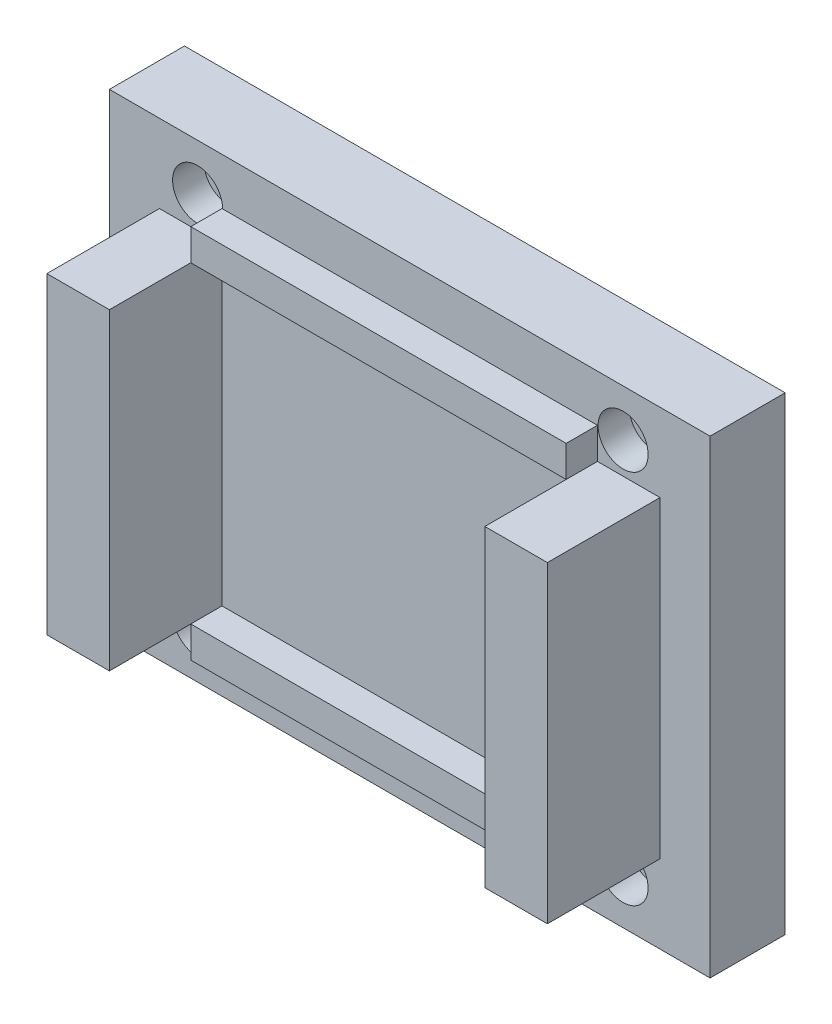
from build123d import *

# Parameters (mm, degrees)
SKETCH_1_W          = 96
SKETCH_1_H          = 75
EXTRUDE_1_DEPTH     = 12
SKETCH_2_R          = 4
CUT_EXTRUDE_1_DEPTH = 5
SKETCH_3_R          = 2.5
CUT_EXTRUDE_2_DEPTH = 123.413234579
SKETCH_4_W          = 10
SKETCH_4_H          = 50
EXTRUDE_2_DEPTH     = 18
SKETCH_5_W          = 60
SKETCH_5_H          = 5
EXTRUDE_7_DEPTH     = 5
SKETCH_6_W          = 60
SKETCH_6_H          = 5
EXTRUDE_8_DEPTH     = 5


with BuildPart() as part:
    # 스케치1 → 보스-돌출1 (new body)
    with BuildSketch(Plane.XY):
        with Locations((48, 37.5)):
            Rectangle(SKETCH_1_W, SKETCH_1_H)
    extrude(amount=EXTRUDE_1_DEPTH)

    # 스케치2 → 컷-돌출1 (cut)
    with BuildSketch(Plane.XY.offset(12)):
        with Locations((14.09562434, 67.5)):
            Circle(SKETCH_2_R)
        with Locations((82.09562434, 67.5)):
            Circle(SKETCH_2_R)
        with Locations((82.09562434, 7.5)):
            Circle(SKETCH_2_R)
        with Locations((14.09562434, 7.5)):
            Circle(SKETCH_2_R)
    extrude(amount=-CUT_EXTRUDE_1_DEPTH, mode=Mode.SUBTRACT)

    # 스케치3 → 컷-돌출2 (cut, through all)
    with BuildSketch(Plane.XY.offset(12)):
        with Locations((14.09562434, 67.5)):
            Circle(SKETCH_3_R)
        with Locations((82.09562434, 67.5)):
            Circle(SKETCH_3_R)
        with Locations((82.09562434, 7.5)):
            Circle(SKETCH_3_R)
        with Locations((14.09562434, 7.5)):
            Circle(SKETCH_3_R)
    extrude(amount=-CUT_EXTRUDE_2_DEPTH, mode=Mode.SUBTRACT)

    # 스케치4 → 보스-돌출2 (add)
    with BuildSketch(Plane.XY.offset(12)):
        with Locations((13, 37.5)):
            Rectangle(SKETCH_4_W, SKETCH_4_H)
        with Locations((83, 37.5)):
            Rectangle(SKETCH_4_W, SKETCH_4_H)
    extrude(amount=EXTRUDE_2_DEPTH)


with BuildPart() as body_2:
    # 스케치5 → 보스-돌출7 (new body)
    with BuildSketch(Plane.XY.offset(12)):
        with Locations((48, 65)):
            Rectangle(SKETCH_5_W, SKETCH_5_H)
    extrude(amount=EXTRUDE_7_DEPTH)


with BuildPart() as body_3:
    # 스케치6 → 보스-돌출8 (new body)
    with BuildSketch(Plane.XY.offset(12)):
        with Locations((48, 10)):
            Rectangle(SKETCH_6_W, SKETCH_6_H)
    extrude(amount=EXTRUDE_8_DEPTH)


solid = Compound([part.part, body_2.part, body_3.part])
